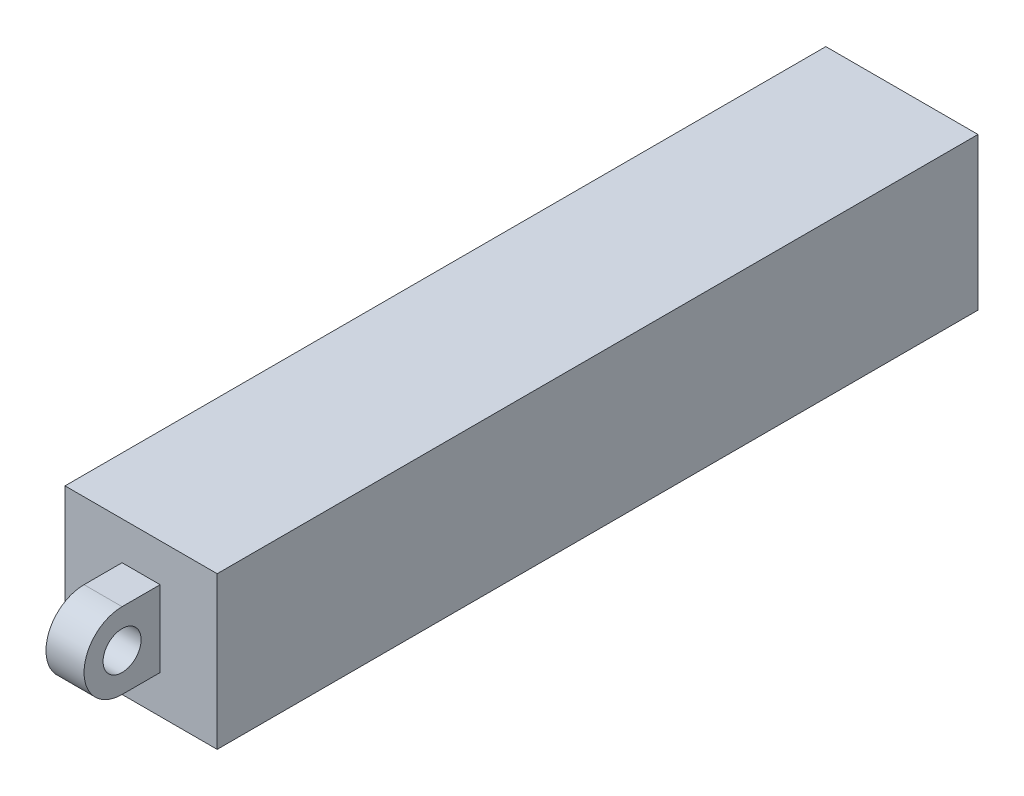
from build123d import *

# Parameters (mm, degrees)
SKETCH_2_W      = 50
SKETCH_2_H      = 10
EXTRUDE_1_DEPTH = 5
SKETCH_3_R      = 1.25
EXTRUDE_2_DEPTH = 1.25


with BuildPart() as part:
    # 스케치2 → 보스-돌출1 (new, symmetric)
    with BuildSketch(Plane(origin=(0, 0, 0), x_dir=(0, 0, -1), z_dir=(1, 0, 0))):
        Rectangle(SKETCH_2_W, SKETCH_2_H)
    extrude(amount=EXTRUDE_1_DEPTH, both=True)

    # 스케치3 → 보스-돌출2 (add, symmetric)
    with BuildSketch(Plane(origin=(0, 0, 0), x_dir=(0, 0, -1), z_dir=(1, 0, 0))):
        with BuildLine():
            Line((-27.5, 2.5), (-25, 2.5))
            Line((-25, 2.5), (-25, -2.5))
            Line((-25, -2.5), (-27.5, -2.5))
            ThreePointArc((-27.5, -2.5), (-30, 0), (-27.5, 2.5))
        make_face()
        with Locations((-27.5, 0)):
            Circle(SKETCH_3_R, mode=Mode.SUBTRACT)
    extrude(amount=EXTRUDE_2_DEPTH, both=True)


solid = part.part
